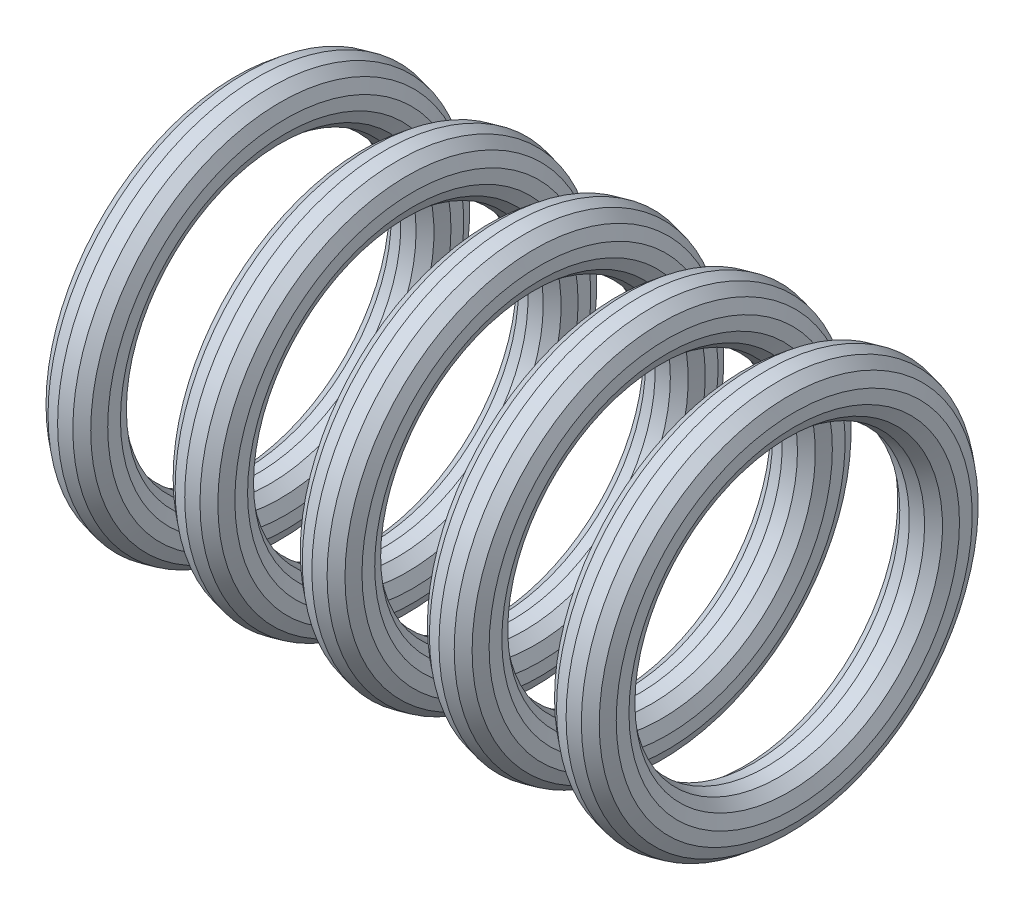
from build123d import *


with BuildPart() as part:
    # 草图1 → 旋转1 (revolve)
    with BuildSketch(Plane.XY, mode=Mode.PRIVATE) as revolve_1_sk:
        Polygon((1, 7), (1.433883739, 6.900968868), (1.781831482, 6.623489802), (1.974927912, 6.222520934), (1.974927912, 5.777479066), (1.781831482, 5.376510198), (1.433883739, 5.099031132), (1, 5), (0.566116261, 5.099031132), (0.218168518, 5.376510198), (0.025072088, 5.777479066), (0.025072088, 6.222520934), (0.218168518, 6.623489802), (0.566116261, 6.900968868), align=None)
    revolve(revolve_1_sk.sketch.rotate(Axis((-2, 0, 0), (1, 0, 0)), 90), axis=Axis((-2, 0, 0), (1, 0, 0)))


with BuildPart() as body_2:
    # 草图2 → 旋转2 (revolve)
    with BuildSketch(Plane.XY, mode=Mode.PRIVATE) as revolve_2_sk:
        Polygon((5.444444444, 7), (5.878328184, 6.900968868), (6.226275927, 6.623489802), (6.419372357, 6.222520934), (6.419372357, 5.777479066), (6.226275927, 5.376510198), (5.878328184, 5.099031132), (5.444444444, 5), (5.010560705, 5.099031132), (4.662612962, 5.376510198), (4.469516532, 5.777479066), (4.469516532, 6.222520934), (4.662612962, 6.623489802), (5.010560705, 6.900968868), align=None)
    revolve(revolve_2_sk.sketch.rotate(Axis((-2, 0, 0), (1, 0, 0)), 90), axis=Axis((-2, 0, 0), (1, 0, 0)))


with BuildPart() as body_3:
    # 草图3 → 旋转3 (revolve)
    with BuildSketch(Plane.XY, mode=Mode.PRIVATE) as revolve_3_sk:
        Polygon((9.888888889, 7), (10.322772628, 6.900968868), (10.670720371, 6.623489802), (10.863816801, 6.222520934), (10.863816801, 5.777479066), (10.670720371, 5.376510198), (10.322772628, 5.099031132), (9.888888889, 5), (9.45500515, 5.099031132), (9.107057406, 5.376510198), (8.913960977, 5.777479066), (8.913960977, 6.222520934), (9.107057406, 6.623489802), (9.45500515, 6.900968868), align=None)
    revolve(revolve_3_sk.sketch.rotate(Axis((-2, 0, 0), (1, 0, 0)), 90), axis=Axis((-2, 0, 0), (1, 0, 0)))


with BuildPart() as body_4:
    # 草图4 → 旋转4 (revolve)
    with BuildSketch(Plane.XY, mode=Mode.PRIVATE) as revolve_4_sk:
        Polygon((14.333333333, 7), (14.767217072, 6.900968868), (15.115164816, 6.623489802), (15.308261246, 6.222520934), (15.308261246, 5.777479066), (15.115164816, 5.376510198), (14.767217072, 5.099031132), (14.333333333, 5), (13.899449594, 5.099031132), (13.551501851, 5.376510198), (13.358405421, 5.777479066), (13.358405421, 6.222520934), (13.551501851, 6.623489802), (13.899449594, 6.900968868), align=None)
    revolve(revolve_4_sk.sketch.rotate(Axis((-2, 0, 0), (1, 0, 0)), 90), axis=Axis((-2, 0, 0), (1, 0, 0)))


with BuildPart() as body_5:
    # 草图5 → 旋转5 (revolve)
    with BuildSketch(Plane.XY, mode=Mode.PRIVATE) as revolve_5_sk:
        Polygon((18.777777778, 7), (19.211661517, 6.900968868), (19.55960926, 6.623489802), (19.75270569, 6.222520934), (19.75270569, 5.777479066), (19.55960926, 5.376510198), (19.211661517, 5.099031132), (18.777777778, 5), (18.343894039, 5.099031132), (17.995946295, 5.376510198), (17.802849866, 5.777479066), (17.802849866, 6.222520934), (17.995946295, 6.623489802), (18.343894039, 6.900968868), align=None)
    revolve(revolve_5_sk.sketch.rotate(Axis((-2, 0, 0), (1, 0, 0)), 90), axis=Axis((-2, 0, 0), (1, 0, 0)))


solid = Compound([part.part, body_2.part, body_3.part, body_4.part, body_5.part])
